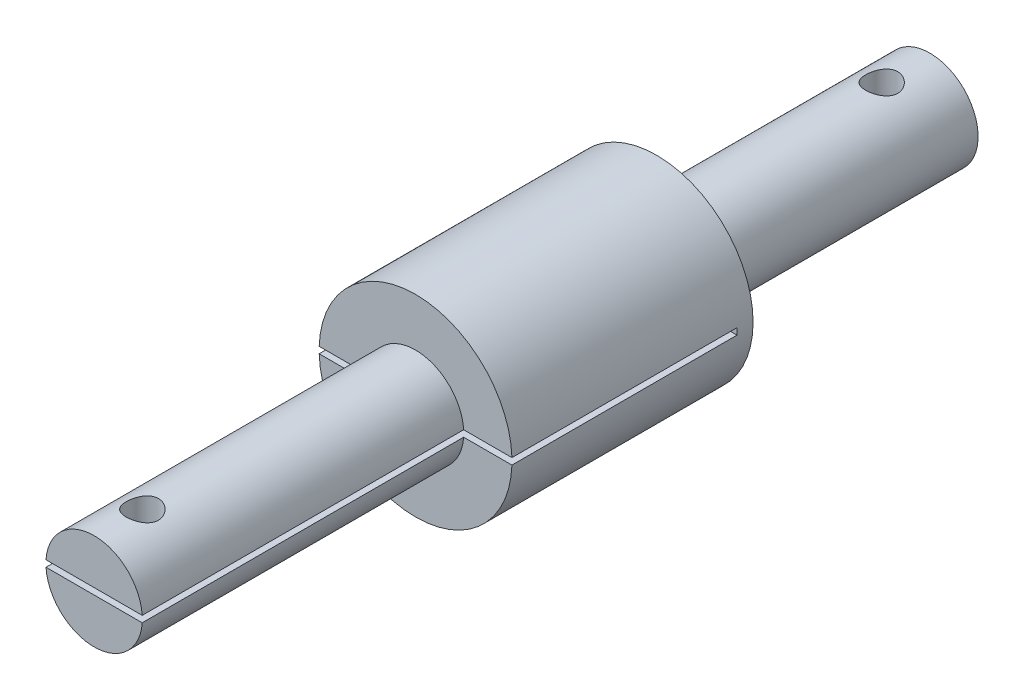
from build123d import *

# Parameters (mm, degrees)
SKETCH_1_R               = 6
EXTRUDE_1_DEPTH          = 15
SKETCH_2_R               = 3
EXTRUDE_2_DEPTH          = 20
EXTRUDE_START            = 17
SKETCH_3_R               = 3
EXTRUDE_3_DEPTH          = 17
CUT_EXTRUDE_1_DEPTH      = 10
CUT_EXTRUDE_1_DEPTH_BACK = 10
SKETCH_5_R               = 1
SKETCH_7_W               = 14.322953254
SKETCH_7_H               = 0.4
CUT_EXTRUDE_2_DEPTH      = 34


with BuildPart() as part:
    # 草图1 → 凸台-拉伸1 (new body)
    with BuildSketch(Plane.XY):
        Circle(SKETCH_1_R)
    extrude(amount=EXTRUDE_1_DEPTH)

    # 草图2 → 凸台-拉伸2 (add)
    with BuildSketch(Plane.XY.offset(15)):
        Circle(SKETCH_2_R)
    extrude(amount=EXTRUDE_2_DEPTH)

    # 草图3 → 凸台-拉伸3 (add)
    with BuildSketch(Plane(origin=(0, 0, 0), x_dir=(-1, 0, 0), z_dir=(0, 0, -1)).offset(EXTRUDE_START)):
        Circle(SKETCH_3_R)
    extrude(amount=-EXTRUDE_3_DEPTH)

    # 草图5 → 切除-拉伸1 (cut, two sides: drawn at the far end of the back side and taken through both)
    with BuildSketch(Plane(origin=(0, 0, 0), x_dir=(1, 0, 0), z_dir=(0, 1, 0)).offset(-CUT_EXTRUDE_1_DEPTH_BACK)):
        with Locations((0, -32)):
            Circle(SKETCH_5_R)
        with Locations((0, 14)):
            Circle(SKETCH_5_R)
    extrude(amount=CUT_EXTRUDE_1_DEPTH + CUT_EXTRUDE_1_DEPTH_BACK, mode=Mode.SUBTRACT)

    # 草图7 → 切除-拉伸2 (cut)
    with BuildSketch(Plane.XY.offset(35)):
        with Locations((-0.299039341, 0)):
            Rectangle(SKETCH_7_W, SKETCH_7_H)
    extrude(amount=-CUT_EXTRUDE_2_DEPTH, mode=Mode.SUBTRACT)


solid = part.part
